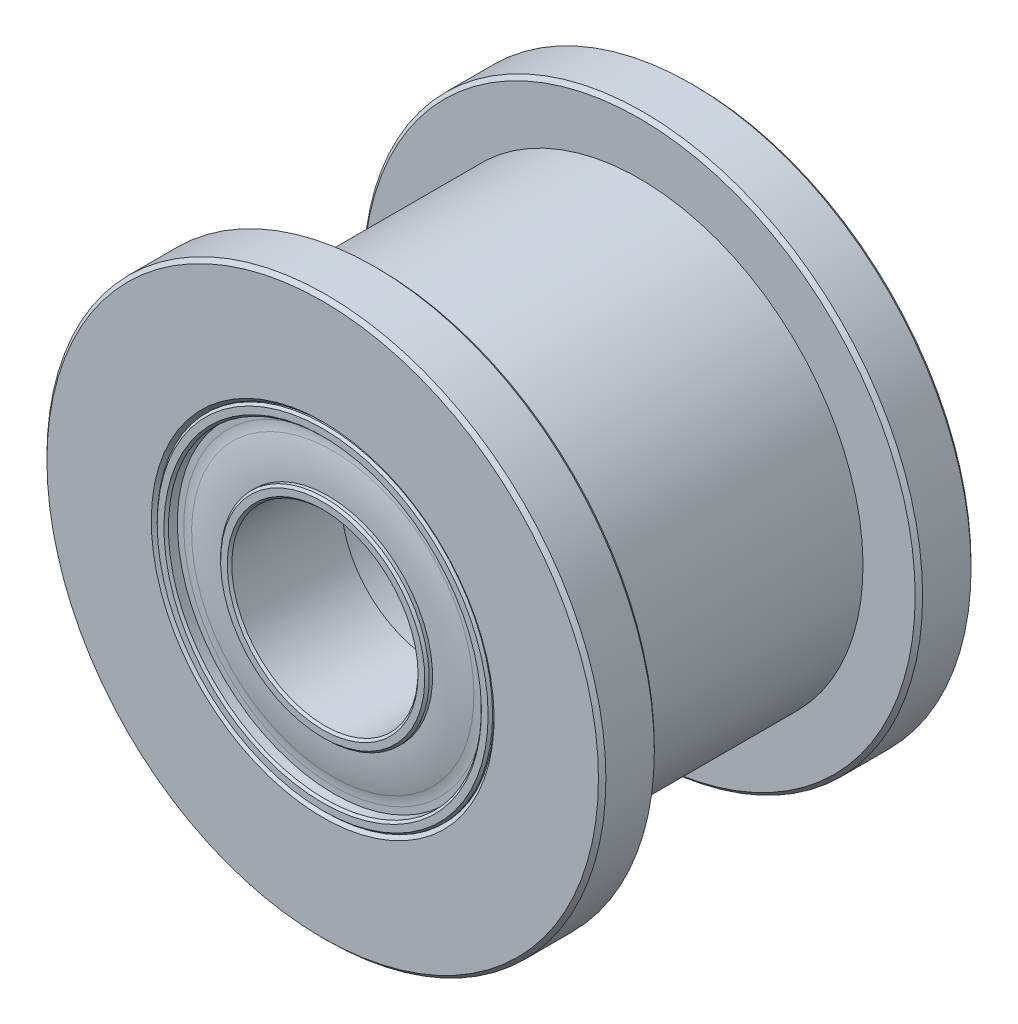
from build123d import *

# Parameters (mm, degrees)
CHAMFER2_SIZE = 0.06
FILLET2_R     = 1
CHAMFER1_SIZE = 0.1


with BuildPart() as part:
    # Sketch2 → Revolve1 (revolve)
    with BuildSketch(Plane(origin=(0, 0, 0), x_dir=(0, 0, -1), z_dir=(1, 0, 0)), mode=Mode.PRIVATE) as revolve1_sk:
        with BuildLine():
            Line((5, 2.5), (2, 2.5))
            Line((2, 2.5), (2, 4.5))
            Line((2, 4.5), (5, 4.5))
            Line((5, 4.5), (5, 4.2))
            Line((5, 4.2), (4.7, 4.2))
            Line((4.7, 4.2), (4.7, 3.9))
            ThreePointArc((4.7, 3.9), (4.812327274, 3.355090083), (4.85, 2.8))
            Line((4.85, 2.8), (5, 2.8))
            Line((5, 2.8), (5, 2.5))
        make_face()
    revolve(revolve1_sk.sketch.rotate(Axis((0, 0, 5), (0, 0, -1)), 180), axis=Axis((0, 0, 5), (0, 0, -1)))

    # Chamfer2
    chamfer2_edges = [part.edges().sort_by_distance(p)[0] for p in [
        (0, 2.5, -5),
        (0, 2.8, -5),
        (0, 4.2, -5),
        (0, 4.5, -5),
    ]]
    chamfer(chamfer2_edges, length=CHAMFER2_SIZE)

    # Fillet2
    fillet2_edges = [part.edges().sort_by_distance(p)[0] for p in [
        (0, 3.9, -4.7),
    ]]
    fillet(fillet2_edges, radius=FILLET2_R)


with BuildPart() as body_2:
    # Mirror1: mirrored copy
    add(part.part.mirror(Plane.XY))


with BuildPart() as body_3:
    # Sketch3 → Revolve2 (revolve)
    with BuildSketch(Plane(origin=(0, 0, 0), x_dir=(0, 0, -1), z_dir=(1, 0, 0)), mode=Mode.PRIVATE) as revolve2_sk:
        Polygon((3.5, 7.5), (5, 7.5), (5, 4.5), (2, 4.5), (2, 3.5), (-2, 3.5), (-2, 4.5), (-5, 4.5), (-5, 7.5), (-3.5, 7.5), (-3.5, 6), (3.5, 6), align=None)
    revolve(revolve2_sk.sketch.rotate(Axis((0, 0, 5), (0, 0, -1)), 180), axis=Axis((0, 0, 5), (0, 0, -1)))

    # Chamfer1
    chamfer1_edges = [body_3.edges().sort_by_distance(p)[0] for p in [
        (0, 4.5, 5),
        (0, 4.5, -5),
        (0, 7.5, -5),
        (0, 7.5, -3.5),
        (0, 7.5, 3.5),
        (0, 7.5, 5),
    ]]
    chamfer(chamfer1_edges, length=CHAMFER1_SIZE)


solid = Compound([part.part, body_2.part, body_3.part])
